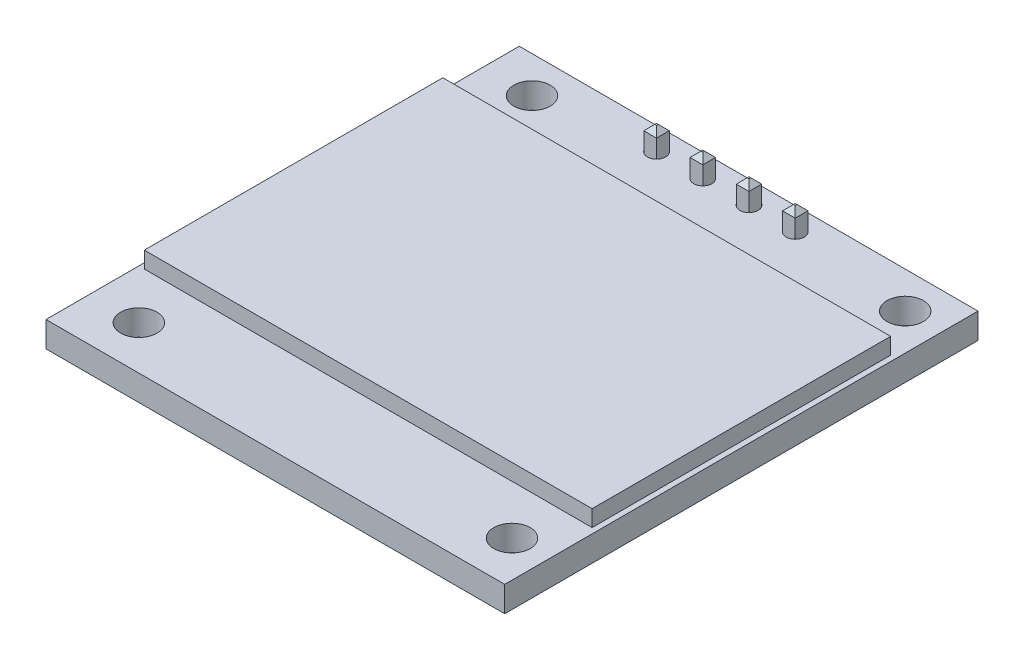
from build123d import *

# Parameters (mm, degrees)
SKETCH1_W                = 25.2
SKETCH1_H                = 26
SKETCH1_R                = 1
SKETCH1_R_2              = 0.5
BOSS_EXTRUDE1_DEPTH      = 1.4
SKETCH2_W                = 24.6
SKETCH2_H                = 16.4
BOSS_EXTRUDE2_DEPTH      = 0.9
SKETCH3_W                = 10.16
SKETCH3_H                = 2.54
BOSS_EXTRUDE3_DEPTH      = 1
BOSS_EXTRUDE4_DEPTH      = 8.6
BOSS_EXTRUDE4_DEPTH_BACK = 2.7
SKETCH4_W                = 0.7
SKETCH4_H                = 0.7
CHAMFER1_SIZE            = 0.3
SKETCH5_W                = 21.744
SKETCH5_H                = 10.864
BOSS_EXTRUDE5_DEPTH      = 0.01


with BuildPart() as part:
    # Sketch1 → Boss-Extrude1 (new body)
    with BuildSketch(Plane(origin=(0, 0, 0), x_dir=(1, 0, 0), z_dir=(0, 1, 0))):
        Rectangle(SKETCH1_W, SKETCH1_H)
        with Locations(Location((-9.9, 11, 0), (0, 0, 270))):
            Circle(SKETCH1_R, mode=Mode.SUBTRACT)
        with Locations(Location((10.6, 11, 0), (0, 0, 270))):
            Circle(SKETCH1_R, mode=Mode.SUBTRACT)
        with Locations(Location((-9.9, -10.6, 0), (0, 0, 270))):
            Circle(SKETCH1_R, mode=Mode.SUBTRACT)
        with Locations(Location((10.6, -10.6, 0), (0, 0, 270))):
            Circle(SKETCH1_R, mode=Mode.SUBTRACT)
        with Locations(Location((-3.81, 11.75, 0), (0, 0, 270))):
            Circle(SKETCH1_R_2, mode=Mode.SUBTRACT)
        with Locations(Location((-1.27, 11.75, 0), (0, 0, 270))):
            Circle(SKETCH1_R_2, mode=Mode.SUBTRACT)
        with Locations(Location((1.27, 11.75, 0), (0, 0, 270))):
            Circle(SKETCH1_R_2, mode=Mode.SUBTRACT)
        with Locations(Location((3.81, 11.75, 0), (0, 0, 270))):
            Circle(SKETCH1_R_2, mode=Mode.SUBTRACT)
    extrude(amount=BOSS_EXTRUDE1_DEPTH)

    # Sketch2 → Boss-Extrude2 (add)
    with BuildSketch(Plane(origin=(0, 1.4, 0), x_dir=(1, 0, 0), z_dir=(0, 1, 0))):
        with Locations((0, 0.3)):
            Rectangle(SKETCH2_W, SKETCH2_H)
    extrude(amount=BOSS_EXTRUDE2_DEPTH)

    # Sketch3 → Boss-Extrude3 (add)
    with BuildSketch(Plane.XZ):
        with Locations((0, -11.75)):
            Rectangle(SKETCH3_W, SKETCH3_H)
    extrude(amount=BOSS_EXTRUDE3_DEPTH)

    # Sketch4 → Boss-Extrude4 (add, two sides: drawn at the far end of the back side and taken through both)
    with BuildSketch(Plane.XZ.offset(-BOSS_EXTRUDE4_DEPTH_BACK)):
        with Locations((-3.81, -11.75)):
            Rectangle(SKETCH4_W, SKETCH4_H)
        with Locations((-1.27, -11.75)):
            Rectangle(SKETCH4_W, SKETCH4_H)
        with Locations((1.27, -11.75)):
            Rectangle(SKETCH4_W, SKETCH4_H)
        with Locations((3.81, -11.75)):
            Rectangle(SKETCH4_W, SKETCH4_H)
    extrude(amount=BOSS_EXTRUDE4_DEPTH + BOSS_EXTRUDE4_DEPTH_BACK)

    # Chamfer1
    chamfer1_edges = [part.edges().sort_by_distance(p)[0] for p in [
        (-0.92, 2.7, -11.75),
        (-1.27, 2.7, -12.1),
        (-1.62, 2.7, -11.75),
        (-1.27, 2.7, -11.4),
        (-0.92, -8.6, -11.75),
        (-1.27, -8.6, -11.4),
        (-1.62, -8.6, -11.75),
        (-1.27, -8.6, -12.1),
        (1.62, 2.7, -11.75),
        (1.27, 2.7, -12.1),
        (0.92, 2.7, -11.75),
        (1.27, 2.7, -11.4),
        (1.62, -8.6, -11.75),
        (1.27, -8.6, -11.4),
        (0.92, -8.6, -11.75),
        (1.27, -8.6, -12.1),
        (4.16, 2.7, -11.75),
        (3.81, 2.7, -12.1),
        (3.46, 2.7, -11.75),
        (3.81, 2.7, -11.4),
        (4.16, -8.6, -11.75),
        (3.81, -8.6, -11.4),
        (3.46, -8.6, -11.75),
        (3.81, -8.6, -12.1),
        (-3.46, 2.7, -11.75),
        (-3.81, 2.7, -12.1),
        (-4.16, 2.7, -11.75),
        (-3.81, 2.7, -11.4),
        (-3.46, -8.6, -11.75),
        (-3.81, -8.6, -11.4),
        (-4.16, -8.6, -11.75),
        (-3.81, -8.6, -12.1),
    ]]
    chamfer(chamfer1_edges, length=CHAMFER1_SIZE)

    # Sketch5 → Boss-Extrude5 (add)
    with BuildSketch(Plane.XZ):
        with Locations((0, -1.198)):
            Rectangle(SKETCH5_W, SKETCH5_H)
    extrude(amount=BOSS_EXTRUDE5_DEPTH)


solid = part.part
